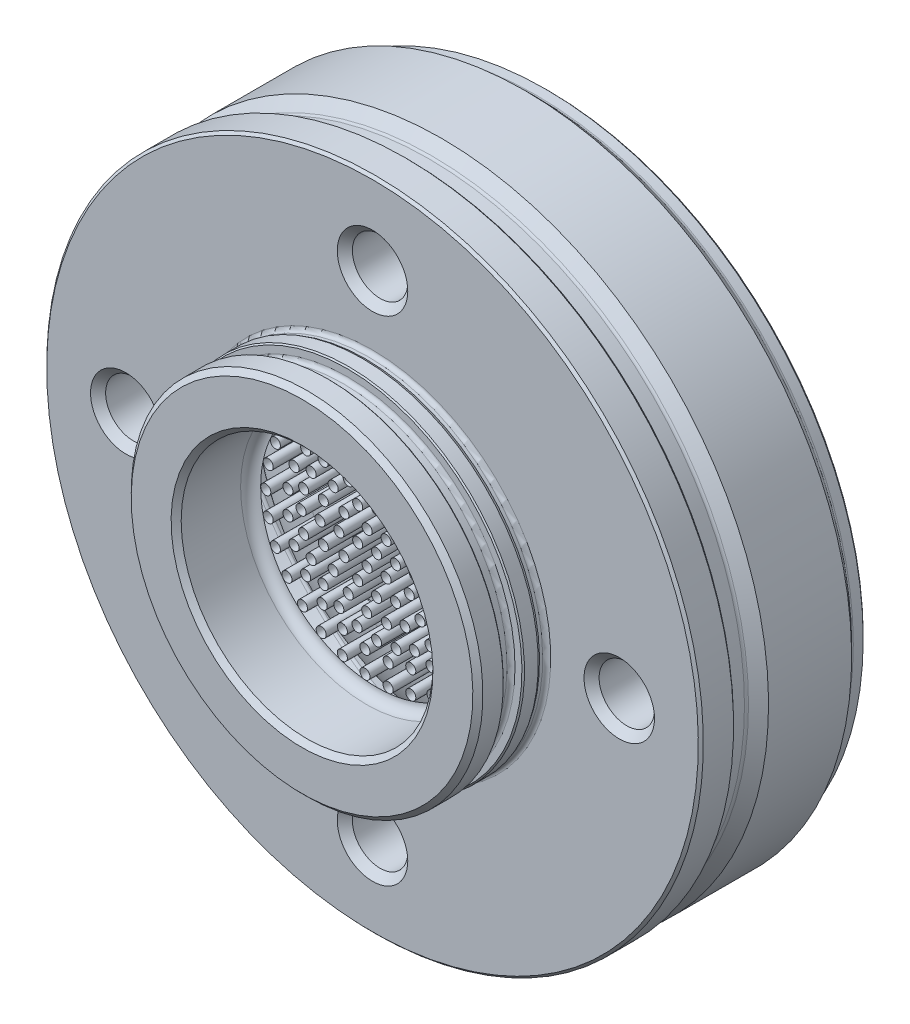
from build123d import *

# Parameters (mm, degrees)
M2_0_2_DIAMETER_HOLE5_AT_2_COUNT     = 2
M2_0_2_DIAMETER_HOLE5_AT_2_PITCH     = 3.75
M2_0_2_DIAMETER_HOLE5_AT_3_COUNT     = 2
M2_0_2_DIAMETER_HOLE5_AT_3_PITCH     = 7.5
M2_0_2_DIAMETER_HOLE5_AT_4_COUNT     = 2
M2_0_2_DIAMETER_HOLE5_AT_4_PITCH     = 11.25
M2_0_2_DIAMETER_HOLE5_AT_5_COUNT     = 2
M2_0_2_DIAMETER_HOLE5_AT_5_PITCH     = 15
M2_0_2_DIAMETER_HOLE5_AT_6_COUNT     = 2
M2_0_2_DIAMETER_HOLE5_AT_6_PITCH     = 22
M2_0_2_DIAMETER_HOLE5_AT_7_COUNT     = 2
M2_0_2_DIAMETER_HOLE5_AT_7_PITCH     = 17.75
M2_0_2_DIAMETER_HOLE5_AT_8_COUNT     = 2
M2_0_2_DIAMETER_HOLE5_AT_8_PITCH     = 3.75
M2_0_2_DIAMETER_HOLE5_AT_9_COUNT     = 2
M2_0_2_DIAMETER_HOLE5_AT_9_PITCH     = 3.75
M2_0_2_DIAMETER_HOLE5_AT_10_COUNT    = 2
M2_0_2_DIAMETER_HOLE5_AT_10_PITCH    = 3.75
M2_0_2_DIAMETER_HOLE5_AT_11_COUNT    = 2
M2_0_2_DIAMETER_HOLE5_AT_11_PITCH    = 3.75
M2_0_2_DIAMETER_HOLE5_AT_12_COUNT    = 2
M2_0_2_DIAMETER_HOLE5_AT_12_PITCH    = 3.75
M2_0_2_DIAMETER_HOLE5_AT_13_COUNT    = 2
M2_0_2_DIAMETER_HOLE5_AT_13_PITCH    = 7.5
M2_0_2_DIAMETER_HOLE5_AT_14_COUNT    = 2
M2_0_2_DIAMETER_HOLE5_AT_14_PITCH    = 7.5
M2_0_2_DIAMETER_HOLE5_AT_15_COUNT    = 2
M2_0_2_DIAMETER_HOLE5_AT_15_PITCH    = 7.5
M2_0_2_DIAMETER_HOLE5_AT_16_COUNT    = 2
M2_0_2_DIAMETER_HOLE5_AT_16_PITCH    = 7.5
M2_0_2_DIAMETER_HOLE5_AT_17_COUNT    = 2
M2_0_2_DIAMETER_HOLE5_AT_17_PITCH    = 7.5
M2_0_2_DIAMETER_HOLE5_AT_18_COUNT    = 2
M2_0_2_DIAMETER_HOLE5_AT_18_PITCH    = 7.5
M2_0_2_DIAMETER_HOLE5_AT_19_COUNT    = 2
M2_0_2_DIAMETER_HOLE5_AT_19_PITCH    = 7.5
M2_0_2_DIAMETER_HOLE5_AT_20_COUNT    = 2
M2_0_2_DIAMETER_HOLE5_AT_20_PITCH    = 7.5
M2_0_2_DIAMETER_HOLE5_AT_21_COUNT    = 2
M2_0_2_DIAMETER_HOLE5_AT_21_PITCH    = 7.5
M2_0_2_DIAMETER_HOLE5_AT_22_COUNT    = 2
M2_0_2_DIAMETER_HOLE5_AT_22_PITCH    = 7.5
M2_0_2_DIAMETER_HOLE5_AT_23_COUNT    = 2
M2_0_2_DIAMETER_HOLE5_AT_23_PITCH    = 7.5
M2_0_2_DIAMETER_HOLE5_AT_24_COUNT    = 2
M2_0_2_DIAMETER_HOLE5_AT_24_PITCH    = 11.25
M2_0_2_DIAMETER_HOLE5_AT_25_COUNT    = 2
M2_0_2_DIAMETER_HOLE5_AT_25_PITCH    = 11.25
M2_0_2_DIAMETER_HOLE5_AT_26_COUNT    = 2
M2_0_2_DIAMETER_HOLE5_AT_26_PITCH    = 11.25
M2_0_2_DIAMETER_HOLE5_AT_27_COUNT    = 2
M2_0_2_DIAMETER_HOLE5_AT_27_PITCH    = 11.25
M2_0_2_DIAMETER_HOLE5_AT_28_COUNT    = 2
M2_0_2_DIAMETER_HOLE5_AT_28_PITCH    = 11.25
M2_0_2_DIAMETER_HOLE5_AT_29_COUNT    = 2
M2_0_2_DIAMETER_HOLE5_AT_29_PITCH    = 11.25
M2_0_2_DIAMETER_HOLE5_AT_30_COUNT    = 2
M2_0_2_DIAMETER_HOLE5_AT_30_PITCH    = 11.25
M2_0_2_DIAMETER_HOLE5_AT_31_COUNT    = 2
M2_0_2_DIAMETER_HOLE5_AT_31_PITCH    = 11.25
M2_0_2_DIAMETER_HOLE5_AT_32_COUNT    = 2
M2_0_2_DIAMETER_HOLE5_AT_32_PITCH    = 11.25
M2_0_2_DIAMETER_HOLE5_AT_33_COUNT    = 2
M2_0_2_DIAMETER_HOLE5_AT_33_PITCH    = 11.25
M2_0_2_DIAMETER_HOLE5_AT_34_COUNT    = 2
M2_0_2_DIAMETER_HOLE5_AT_34_PITCH    = 11.25
M2_0_2_DIAMETER_HOLE5_AT_35_COUNT    = 2
M2_0_2_DIAMETER_HOLE5_AT_35_PITCH    = 11.25
M2_0_2_DIAMETER_HOLE5_AT_36_COUNT    = 2
M2_0_2_DIAMETER_HOLE5_AT_36_PITCH    = 11.25
M2_0_2_DIAMETER_HOLE5_AT_37_COUNT    = 2
M2_0_2_DIAMETER_HOLE5_AT_37_PITCH    = 11.25
M2_0_2_DIAMETER_HOLE5_AT_38_COUNT    = 2
M2_0_2_DIAMETER_HOLE5_AT_38_PITCH    = 11.25
M2_0_2_DIAMETER_HOLE5_AT_39_COUNT    = 2
M2_0_2_DIAMETER_HOLE5_AT_39_PITCH    = 11.25
M2_0_2_DIAMETER_HOLE5_AT_40_COUNT    = 2
M2_0_2_DIAMETER_HOLE5_AT_40_PITCH    = 11.25
M2_0_2_DIAMETER_HOLE5_AT_41_COUNT    = 2
M2_0_2_DIAMETER_HOLE5_AT_41_PITCH    = 15
M2_0_2_DIAMETER_HOLE5_AT_42_COUNT    = 2
M2_0_2_DIAMETER_HOLE5_AT_42_PITCH    = 15
M2_0_2_DIAMETER_HOLE5_AT_43_COUNT    = 2
M2_0_2_DIAMETER_HOLE5_AT_43_PITCH    = 15
M2_0_2_DIAMETER_HOLE5_AT_44_COUNT    = 2
M2_0_2_DIAMETER_HOLE5_AT_44_PITCH    = 15
M2_0_2_DIAMETER_HOLE5_AT_45_COUNT    = 2
M2_0_2_DIAMETER_HOLE5_AT_45_PITCH    = 15
M2_0_2_DIAMETER_HOLE5_AT_46_COUNT    = 2
M2_0_2_DIAMETER_HOLE5_AT_46_PITCH    = 15
M2_0_2_DIAMETER_HOLE5_AT_47_COUNT    = 2
M2_0_2_DIAMETER_HOLE5_AT_47_PITCH    = 15
M2_0_2_DIAMETER_HOLE5_AT_48_COUNT    = 2
M2_0_2_DIAMETER_HOLE5_AT_48_PITCH    = 15
M2_0_2_DIAMETER_HOLE5_AT_49_COUNT    = 2
M2_0_2_DIAMETER_HOLE5_AT_49_PITCH    = 15
M2_0_2_DIAMETER_HOLE5_AT_50_COUNT    = 2
M2_0_2_DIAMETER_HOLE5_AT_50_PITCH    = 15
M2_0_2_DIAMETER_HOLE5_AT_51_COUNT    = 2
M2_0_2_DIAMETER_HOLE5_AT_51_PITCH    = 15
M2_0_2_DIAMETER_HOLE5_AT_52_COUNT    = 2
M2_0_2_DIAMETER_HOLE5_AT_52_PITCH    = 15
M2_0_2_DIAMETER_HOLE5_AT_53_COUNT    = 2
M2_0_2_DIAMETER_HOLE5_AT_53_PITCH    = 15
M2_0_2_DIAMETER_HOLE5_AT_54_COUNT    = 2
M2_0_2_DIAMETER_HOLE5_AT_54_PITCH    = 15
M2_0_2_DIAMETER_HOLE5_AT_55_COUNT    = 2
M2_0_2_DIAMETER_HOLE5_AT_55_PITCH    = 15
M2_0_2_DIAMETER_HOLE5_AT_56_COUNT    = 2
M2_0_2_DIAMETER_HOLE5_AT_56_PITCH    = 15
M2_0_2_DIAMETER_HOLE5_AT_57_COUNT    = 2
M2_0_2_DIAMETER_HOLE5_AT_57_PITCH    = 15
M2_0_2_DIAMETER_HOLE5_AT_58_COUNT    = 2
M2_0_2_DIAMETER_HOLE5_AT_58_PITCH    = 15
M2_0_2_DIAMETER_HOLE5_AT_59_COUNT    = 2
M2_0_2_DIAMETER_HOLE5_AT_59_PITCH    = 15
M2_0_2_DIAMETER_HOLE5_AT_60_COUNT    = 2
M2_0_2_DIAMETER_HOLE5_AT_60_PITCH    = 15
M2_0_2_DIAMETER_HOLE5_AT_61_COUNT    = 2
M2_0_2_DIAMETER_HOLE5_AT_61_PITCH    = 15
M2_0_2_DIAMETER_HOLE5_AT_62_COUNT    = 2
M2_0_2_DIAMETER_HOLE5_AT_62_PITCH    = 15
M2_0_2_DIAMETER_HOLE5_AT_63_COUNT    = 2
M2_0_2_DIAMETER_HOLE5_AT_63_PITCH    = 15
M2_0_2_DIAMETER_HOLE5_AT_64_COUNT    = 2
M2_0_2_DIAMETER_HOLE5_AT_64_PITCH    = 17.75
M2_0_2_DIAMETER_HOLE5_AT_65_COUNT    = 2
M2_0_2_DIAMETER_HOLE5_AT_65_PITCH    = 17.75
M2_0_2_DIAMETER_HOLE5_AT_66_COUNT    = 2
M2_0_2_DIAMETER_HOLE5_AT_66_PITCH    = 17.75
M2_0_2_DIAMETER_HOLE5_AT_67_COUNT    = 2
M2_0_2_DIAMETER_HOLE5_AT_67_PITCH    = 17.75
M2_0_2_DIAMETER_HOLE5_AT_68_COUNT    = 2
M2_0_2_DIAMETER_HOLE5_AT_68_PITCH    = 17.75
M2_0_2_DIAMETER_HOLE5_AT_69_COUNT    = 2
M2_0_2_DIAMETER_HOLE5_AT_69_PITCH    = 17.75
M2_0_2_DIAMETER_HOLE5_AT_70_COUNT    = 2
M2_0_2_DIAMETER_HOLE5_AT_70_PITCH    = 17.75
M2_0_2_DIAMETER_HOLE5_AT_71_COUNT    = 2
M2_0_2_DIAMETER_HOLE5_AT_71_PITCH    = 17.75
M2_0_2_DIAMETER_HOLE5_AT_72_COUNT    = 2
M2_0_2_DIAMETER_HOLE5_AT_72_PITCH    = 17.75
M2_0_2_DIAMETER_HOLE5_AT_73_COUNT    = 2
M2_0_2_DIAMETER_HOLE5_AT_73_PITCH    = 17.75
M2_0_2_DIAMETER_HOLE5_AT_74_COUNT    = 2
M2_0_2_DIAMETER_HOLE5_AT_74_PITCH    = 17.75
M2_0_2_DIAMETER_HOLE5_AT_75_COUNT    = 2
M2_0_2_DIAMETER_HOLE5_AT_75_PITCH    = 17.75
M2_0_2_DIAMETER_HOLE5_AT_76_COUNT    = 2
M2_0_2_DIAMETER_HOLE5_AT_76_PITCH    = 17.75
M2_0_2_DIAMETER_HOLE5_AT_77_COUNT    = 2
M2_0_2_DIAMETER_HOLE5_AT_77_PITCH    = 17.75
M2_0_2_DIAMETER_HOLE5_AT_78_COUNT    = 2
M2_0_2_DIAMETER_HOLE5_AT_78_PITCH    = 17.75
M2_0_2_DIAMETER_HOLE5_AT_79_COUNT    = 2
M2_0_2_DIAMETER_HOLE5_AT_79_PITCH    = 17.75
M2_0_2_DIAMETER_HOLE5_AT_80_COUNT    = 2
M2_0_2_DIAMETER_HOLE5_AT_80_PITCH    = 17.75
M2_0_2_DIAMETER_HOLE5_AT_81_COUNT    = 2
M2_0_2_DIAMETER_HOLE5_AT_81_PITCH    = 17.75
M2_0_2_DIAMETER_HOLE5_AT_82_COUNT    = 2
M2_0_2_DIAMETER_HOLE5_AT_82_PITCH    = 17.75
M2_0_2_DIAMETER_HOLE5_AT_83_COUNT    = 2
M2_0_2_DIAMETER_HOLE5_AT_83_PITCH    = 17.75
M2_0_2_DIAMETER_HOLE5_AT_84_COUNT    = 2
M2_0_2_DIAMETER_HOLE5_AT_84_PITCH    = 17.75
M2_0_2_DIAMETER_HOLE5_AT_85_COUNT    = 2
M2_0_2_DIAMETER_HOLE5_AT_85_PITCH    = 17.75
M2_0_2_DIAMETER_HOLE5_AT_86_COUNT    = 2
M2_0_2_DIAMETER_HOLE5_AT_86_PITCH    = 17.75
M2_0_2_DIAMETER_HOLE5_AT_87_COUNT    = 2
M2_0_2_DIAMETER_HOLE5_AT_87_PITCH    = 22
M2_0_2_DIAMETER_HOLE5_AT_88_COUNT    = 2
M2_0_2_DIAMETER_HOLE5_AT_88_PITCH    = 22
M2_0_2_DIAMETER_HOLE5_AT_89_COUNT    = 2
M2_0_2_DIAMETER_HOLE5_AT_89_PITCH    = 22
M2_0_2_DIAMETER_HOLE5_AT_90_COUNT    = 2
M2_0_2_DIAMETER_HOLE5_AT_90_PITCH    = 22
M2_0_2_DIAMETER_HOLE5_AT_91_COUNT    = 2
M2_0_2_DIAMETER_HOLE5_AT_91_PITCH    = 22
M2_0_2_DIAMETER_HOLE5_AT_92_COUNT    = 2
M2_0_2_DIAMETER_HOLE5_AT_92_PITCH    = 22
M2_0_2_DIAMETER_HOLE5_AT_93_COUNT    = 2
M2_0_2_DIAMETER_HOLE5_AT_93_PITCH    = 22
M2_0_2_DIAMETER_HOLE5_AT_94_COUNT    = 2
M2_0_2_DIAMETER_HOLE5_AT_94_PITCH    = 22
M2_0_2_DIAMETER_HOLE5_AT_95_COUNT    = 2
M2_0_2_DIAMETER_HOLE5_AT_95_PITCH    = 22
M2_0_2_DIAMETER_HOLE5_AT_96_COUNT    = 2
M2_0_2_DIAMETER_HOLE5_AT_96_PITCH    = 22
M2_0_2_DIAMETER_HOLE5_AT_97_COUNT    = 2
M2_0_2_DIAMETER_HOLE5_AT_97_PITCH    = 22
M2_0_2_DIAMETER_HOLE5_AT_98_COUNT    = 2
M2_0_2_DIAMETER_HOLE5_AT_98_PITCH    = 22
M2_0_2_DIAMETER_HOLE5_AT_99_COUNT    = 2
M2_0_2_DIAMETER_HOLE5_AT_99_PITCH    = 22
M2_0_2_DIAMETER_HOLE5_AT_100_COUNT   = 2
M2_0_2_DIAMETER_HOLE5_AT_100_PITCH   = 22
M2_0_2_DIAMETER_HOLE5_AT_101_COUNT   = 2
M2_0_2_DIAMETER_HOLE5_AT_101_PITCH   = 22
M2_0_2_DIAMETER_HOLE5_AT_102_COUNT   = 2
M2_0_2_DIAMETER_HOLE5_AT_102_PITCH   = 22
M2_0_2_DIAMETER_HOLE5_AT_103_COUNT   = 2
M2_0_2_DIAMETER_HOLE5_AT_103_PITCH   = 22
M2_0_2_DIAMETER_HOLE5_AT_104_COUNT   = 2
M2_0_2_DIAMETER_HOLE5_AT_104_PITCH   = 22
M2_0_2_DIAMETER_HOLE5_AT_105_COUNT   = 2
M2_0_2_DIAMETER_HOLE5_AT_105_PITCH   = 22
M2_0_2_DIAMETER_HOLE5_AT_106_COUNT   = 2
M2_0_2_DIAMETER_HOLE5_AT_106_PITCH   = 22
M2_0_2_DIAMETER_HOLE5_AT_107_COUNT   = 2
M2_0_2_DIAMETER_HOLE5_AT_107_PITCH   = 22
M2_0_2_DIAMETER_HOLE5_AT_108_COUNT   = 2
M2_0_2_DIAMETER_HOLE5_AT_108_PITCH   = 22
M2_0_2_DIAMETER_HOLE5_AT_109_COUNT   = 2
M2_0_2_DIAMETER_HOLE5_AT_109_PITCH   = 22
M2_0_2_DIAMETER_HOLE5_AT_110_COUNT   = 2
M2_0_2_DIAMETER_HOLE5_AT_110_PITCH   = 22
M2_0_2_DIAMETER_HOLE5_AT_111_COUNT   = 2
M2_0_2_DIAMETER_HOLE5_AT_111_PITCH   = 22
M2_0_2_DIAMETER_HOLE5_AT_112_COUNT   = 2
M2_0_2_DIAMETER_HOLE5_AT_112_PITCH   = 22
M2_0_2_DIAMETER_HOLE5_AT_113_COUNT   = 2
M2_0_2_DIAMETER_HOLE5_AT_113_PITCH   = 22
M2_0_2_DIAMETER_HOLE5_AT_114_COUNT   = 2
M2_0_2_DIAMETER_HOLE5_AT_114_PITCH   = 22
M2_0_2_DIAMETER_HOLE5_AT_115_COUNT   = 2
M2_0_2_DIAMETER_HOLE5_AT_115_PITCH   = 22
F_11_0_11_DIAMETER_HOLE1_D           = 11
F_11_0_11_DIAMETER_HOLE1_DEPTH       = 12.5
F_11_0_11_DIAMETER_HOLE1_CSINK_D     = 14
F_11_0_11_DIAMETER_HOLE1_CSINK_ANGLE = 90
F_11_0_11_DIAMETER_HOLE1_TIP         = 3.304733405


with BuildPart() as part:
    # Sketch1 → Revolve1 (revolve)
    with BuildSketch(Plane(origin=(0, 0, 0), x_dir=(0, 0, -1), z_dir=(1, 0, 0))):
        with BuildLine():
            Line((0, 50.5), (0, 62.55))
            Line((0, 62.55), (-0.5, 63.05))
            Line((-0.5, 63.05), (-2.46862915, 63.05))
            ThreePointArc((-2.46862915, 63.05), (-2.774775896, 63.110896374), (-3.034314575, 63.284314575))
            Line((-3.034314575, 63.284314575), (-4.675, 64.925))
            Line((-4.675, 64.925), (-21.175, 64.925))
            Line((-21.175, 64.925), (-23.165685425, 62.934314575))
            ThreePointArc((-23.165685425, 62.934314575), (-23.425224104, 62.760896374), (-23.73137085, 62.7))
            Line((-23.73137085, 62.7), (-27.1, 62.7))
            ThreePointArc((-27.1, 62.7), (-27.665685425, 62.934314575), (-27.9, 63.5))
            Line((-27.9, 63.5), (-27.9, 64.7))
            Line((-27.9, 64.7), (-28.4, 65.2))
            Line((-28.4, 65.2), (-34.4, 65.2))
            Line((-34.4, 65.2), (-34.9, 64.7))
            Line((-34.9, 64.7), (-34.9, 35.4))
            ThreePointArc((-34.9, 35.4), (-35.134314575, 34.834314575), (-35.7, 34.6))
            Line((-35.7, 34.6), (-36.337083488, 34.6))
            Line((-36.337083488, 34.6), (-36.9, 34.925))
            Line((-36.9, 34.925), (-39.65, 34.925))
            Line((-39.65, 34.925), (-39.9, 34.675))
            Line((-39.9, 34.675), (-39.9, 33.3))
            ThreePointArc((-39.9, 33.3), (-40.134314575, 32.734314575), (-40.7, 32.5))
            Line((-40.7, 32.5), (-42.8, 32.5))
            ThreePointArc((-42.8, 32.5), (-43.365685425, 32.734314575), (-43.6, 33.3))
            Line((-43.6, 33.3), (-43.6, 34.675))
            Line((-43.6, 34.675), (-43.85, 34.925))
            Line((-43.85, 34.925), (-47.9, 34.925))
            Line((-47.9, 34.925), (-48.9, 33.925))
            Line((-48.9, 33.925), (-48.9, 26))
            Line((-48.9, 26), (-47.9, 25))
            Line((-47.9, 25), (-36.1, 25))
            ThreePointArc((-36.1, 25), (-34.685786438, 24.414213562), (-34.1, 23))
            Line((-34.1, 23), (-34.1, 0))
            Line((-34.1, 0), (-24.8, 0))
            Line((-24.8, 0), (-24.8, 23.589778894))
            ThreePointArc((-24.8, 23.589778894), (-18.448418248, 39.854259621), (-2.755555556, 47.509975433))
            ThreePointArc((-2.755555556, 47.509975433), (-0.793947719, 48.466939909), (0, 50.5))
        make_face()
    revolve(axis=Axis((0, 0, 0), (0, 0, 1)))

    # Sketch13 → M2.0 (2) Diameter Hole5 (revolve, cut)
    with BuildSketch(Plane(origin=(0, 0, 34.1), x_dir=(0, -1, 0), z_dir=(1, 0, 0))):
        Polygon((0, 0), (0, 9.3), (1.1, 9.3), (1, 9.2), (1, 0), align=None)
    m2_0_2_diameter_hole5 = revolve(axis=Axis((0, 0, 40.45), (0, 0, -1)), mode=Mode.SUBTRACT)

    # M2.0 (2) Diameter Hole5 at 2: M2.0 (2) Diameter Hole5 ×2
    with Locations(*[(i * M2_0_2_DIAMETER_HOLE5_AT_2_PITCH, 0, 0) for i in range(1, M2_0_2_DIAMETER_HOLE5_AT_2_COUNT)]):
        add(m2_0_2_diameter_hole5, mode=Mode.SUBTRACT)

    # M2.0 (2) Diameter Hole5 at 3: M2.0 (2) Diameter Hole5 ×2
    with Locations(*[(i * M2_0_2_DIAMETER_HOLE5_AT_3_PITCH, 0, 0) for i in range(1, M2_0_2_DIAMETER_HOLE5_AT_3_COUNT)]):
        add(m2_0_2_diameter_hole5, mode=Mode.SUBTRACT)

    # M2.0 (2) Diameter Hole5 at 4: M2.0 (2) Diameter Hole5 ×2
    with Locations(*[(i * M2_0_2_DIAMETER_HOLE5_AT_4_PITCH, 0, 0) for i in range(1, M2_0_2_DIAMETER_HOLE5_AT_4_COUNT)]):
        add(m2_0_2_diameter_hole5, mode=Mode.SUBTRACT)

    # M2.0 (2) Diameter Hole5 at 5: M2.0 (2) Diameter Hole5 ×2
    with Locations(*[(i * M2_0_2_DIAMETER_HOLE5_AT_5_PITCH, 0, 0) for i in range(1, M2_0_2_DIAMETER_HOLE5_AT_5_COUNT)]):
        add(m2_0_2_diameter_hole5, mode=Mode.SUBTRACT)

    # M2.0 (2) Diameter Hole5 at 6: M2.0 (2) Diameter Hole5 ×2
    with Locations(*[(i * M2_0_2_DIAMETER_HOLE5_AT_6_PITCH, 0, 0) for i in range(1, M2_0_2_DIAMETER_HOLE5_AT_6_COUNT)]):
        add(m2_0_2_diameter_hole5, mode=Mode.SUBTRACT)

    # M2.0 (2) Diameter Hole5 at 7: M2.0 (2) Diameter Hole5 ×2
    with Locations(*[Vector(0.9914448613738122, 0.13052619222003806, 0) * (i * M2_0_2_DIAMETER_HOLE5_AT_7_PITCH) for i in range(1, M2_0_2_DIAMETER_HOLE5_AT_7_COUNT)]):
        add(m2_0_2_diameter_hole5, mode=Mode.SUBTRACT)

    # M2.0 (2) Diameter Hole5 at 8: M2.0 (2) Diameter Hole5 ×2
    with Locations(*[Vector(0.5000000000000118, 0.8660254037844319, 0) * (i * M2_0_2_DIAMETER_HOLE5_AT_8_PITCH) for i in range(1, M2_0_2_DIAMETER_HOLE5_AT_8_COUNT)]):
        add(m2_0_2_diameter_hole5, mode=Mode.SUBTRACT)

    # M2.0 (2) Diameter Hole5 at 9: M2.0 (2) Diameter Hole5 ×2
    with Locations(*[Vector(-0.4999999999999935, 0.8660254037844424, 0) * (i * M2_0_2_DIAMETER_HOLE5_AT_9_PITCH) for i in range(1, M2_0_2_DIAMETER_HOLE5_AT_9_COUNT)]):
        add(m2_0_2_diameter_hole5, mode=Mode.SUBTRACT)

    # M2.0 (2) Diameter Hole5 at 10: M2.0 (2) Diameter Hole5 ×2
    with Locations(*[(-i * M2_0_2_DIAMETER_HOLE5_AT_10_PITCH, 0, 0) for i in range(1, M2_0_2_DIAMETER_HOLE5_AT_10_COUNT)]):
        add(m2_0_2_diameter_hole5, mode=Mode.SUBTRACT)

    # M2.0 (2) Diameter Hole5 at 11: M2.0 (2) Diameter Hole5 ×2
    with Locations(*[Vector(-0.5000000000000026, -0.8660254037844373, 0) * (i * M2_0_2_DIAMETER_HOLE5_AT_11_PITCH) for i in range(1, M2_0_2_DIAMETER_HOLE5_AT_11_COUNT)]):
        add(m2_0_2_diameter_hole5, mode=Mode.SUBTRACT)

    # M2.0 (2) Diameter Hole5 at 12: M2.0 (2) Diameter Hole5 ×2
    with Locations(*[Vector(0.49999999999999645, -0.8660254037844407, 0) * (i * M2_0_2_DIAMETER_HOLE5_AT_12_PITCH) for i in range(1, M2_0_2_DIAMETER_HOLE5_AT_12_COUNT)]):
        add(m2_0_2_diameter_hole5, mode=Mode.SUBTRACT)

    # M2.0 (2) Diameter Hole5 at 13: M2.0 (2) Diameter Hole5 ×2
    with Locations(*[Vector(0.8660254037844458, 0.4999999999999875, 0) * (i * M2_0_2_DIAMETER_HOLE5_AT_13_PITCH) for i in range(1, M2_0_2_DIAMETER_HOLE5_AT_13_COUNT)]):
        add(m2_0_2_diameter_hole5, mode=Mode.SUBTRACT)

    # M2.0 (2) Diameter Hole5 at 14: M2.0 (2) Diameter Hole5 ×2
    with Locations(*[Vector(0.500000000000011, 0.8660254037844324, 0) * (i * M2_0_2_DIAMETER_HOLE5_AT_14_PITCH) for i in range(1, M2_0_2_DIAMETER_HOLE5_AT_14_COUNT)]):
        add(m2_0_2_diameter_hole5, mode=Mode.SUBTRACT)

    # M2.0 (2) Diameter Hole5 at 15: M2.0 (2) Diameter Hole5 ×2
    with Locations(*[(0, i * M2_0_2_DIAMETER_HOLE5_AT_15_PITCH, 0) for i in range(1, M2_0_2_DIAMETER_HOLE5_AT_15_COUNT)]):
        add(m2_0_2_diameter_hole5, mode=Mode.SUBTRACT)

    # M2.0 (2) Diameter Hole5 at 16: M2.0 (2) Diameter Hole5 ×2
    with Locations(*[Vector(-0.49999999999999273, 0.8660254037844428, 0) * (i * M2_0_2_DIAMETER_HOLE5_AT_16_PITCH) for i in range(1, M2_0_2_DIAMETER_HOLE5_AT_16_COUNT)]):
        add(m2_0_2_diameter_hole5, mode=Mode.SUBTRACT)

    # M2.0 (2) Diameter Hole5 at 17: M2.0 (2) Diameter Hole5 ×2
    with Locations(*[Vector(-0.8660254037844354, 0.5000000000000058, 0) * (i * M2_0_2_DIAMETER_HOLE5_AT_17_PITCH) for i in range(1, M2_0_2_DIAMETER_HOLE5_AT_17_COUNT)]):
        add(m2_0_2_diameter_hole5, mode=Mode.SUBTRACT)

    # M2.0 (2) Diameter Hole5 at 18: M2.0 (2) Diameter Hole5 ×2
    with Locations(*[(-i * M2_0_2_DIAMETER_HOLE5_AT_18_PITCH, 0, 0) for i in range(1, M2_0_2_DIAMETER_HOLE5_AT_18_COUNT)]):
        add(m2_0_2_diameter_hole5, mode=Mode.SUBTRACT)

    # M2.0 (2) Diameter Hole5 at 19: M2.0 (2) Diameter Hole5 ×2
    with Locations(*[Vector(-0.8660254037844408, -0.49999999999999634, 0) * (i * M2_0_2_DIAMETER_HOLE5_AT_19_PITCH) for i in range(1, M2_0_2_DIAMETER_HOLE5_AT_19_COUNT)]):
        add(m2_0_2_diameter_hole5, mode=Mode.SUBTRACT)

    # M2.0 (2) Diameter Hole5 at 20: M2.0 (2) Diameter Hole5 ×2
    with Locations(*[Vector(-0.5000000000000033, -0.8660254037844368, 0) * (i * M2_0_2_DIAMETER_HOLE5_AT_20_PITCH) for i in range(1, M2_0_2_DIAMETER_HOLE5_AT_20_COUNT)]):
        add(m2_0_2_diameter_hole5, mode=Mode.SUBTRACT)

    # M2.0 (2) Diameter Hole5 at 21: M2.0 (2) Diameter Hole5 ×2
    with Locations(*[(0, -i * M2_0_2_DIAMETER_HOLE5_AT_21_PITCH, 0) for i in range(1, M2_0_2_DIAMETER_HOLE5_AT_21_COUNT)]):
        add(m2_0_2_diameter_hole5, mode=Mode.SUBTRACT)

    # M2.0 (2) Diameter Hole5 at 22: M2.0 (2) Diameter Hole5 ×2
    with Locations(*[Vector(0.4999999999999972, -0.8660254037844403, 0) * (i * M2_0_2_DIAMETER_HOLE5_AT_22_PITCH) for i in range(1, M2_0_2_DIAMETER_HOLE5_AT_22_COUNT)]):
        add(m2_0_2_diameter_hole5, mode=Mode.SUBTRACT)

    # M2.0 (2) Diameter Hole5 at 23: M2.0 (2) Diameter Hole5 ×2
    with Locations(*[Vector(0.8660254037844374, -0.5000000000000023, 0) * (i * M2_0_2_DIAMETER_HOLE5_AT_23_PITCH) for i in range(1, M2_0_2_DIAMETER_HOLE5_AT_23_COUNT)]):
        add(m2_0_2_diameter_hole5, mode=Mode.SUBTRACT)

    # M2.0 (2) Diameter Hole5 at 24: M2.0 (2) Diameter Hole5 ×2
    with Locations(*[Vector(0.9396926207859131, 0.34202014332565583, 0) * (i * M2_0_2_DIAMETER_HOLE5_AT_24_PITCH) for i in range(1, M2_0_2_DIAMETER_HOLE5_AT_24_COUNT)]):
        add(m2_0_2_diameter_hole5, mode=Mode.SUBTRACT)

    # M2.0 (2) Diameter Hole5 at 25: M2.0 (2) Diameter Hole5 ×2
    with Locations(*[Vector(0.7660444431189863, 0.6427876096865294, 0) * (i * M2_0_2_DIAMETER_HOLE5_AT_25_PITCH) for i in range(1, M2_0_2_DIAMETER_HOLE5_AT_25_COUNT)]):
        add(m2_0_2_diameter_hole5, mode=Mode.SUBTRACT)

    # M2.0 (2) Diameter Hole5 at 26: M2.0 (2) Diameter Hole5 ×2
    with Locations(*[Vector(0.5000000000000107, 0.8660254037844326, 0) * (i * M2_0_2_DIAMETER_HOLE5_AT_26_PITCH) for i in range(1, M2_0_2_DIAMETER_HOLE5_AT_26_COUNT)]):
        add(m2_0_2_diameter_hole5, mode=Mode.SUBTRACT)

    # M2.0 (2) Diameter Hole5 at 27: M2.0 (2) Diameter Hole5 ×2
    with Locations(*[Vector(0.17364817766694066, 0.9848077530122062, 0) * (i * M2_0_2_DIAMETER_HOLE5_AT_27_PITCH) for i in range(1, M2_0_2_DIAMETER_HOLE5_AT_27_COUNT)]):
        add(m2_0_2_diameter_hole5, mode=Mode.SUBTRACT)

    # M2.0 (2) Diameter Hole5 at 28: M2.0 (2) Diameter Hole5 ×2
    with Locations(*[Vector(-0.17364817766692087, 0.9848077530122097, 0) * (i * M2_0_2_DIAMETER_HOLE5_AT_28_PITCH) for i in range(1, M2_0_2_DIAMETER_HOLE5_AT_28_COUNT)]):
        add(m2_0_2_diameter_hole5, mode=Mode.SUBTRACT)

    # M2.0 (2) Diameter Hole5 at 29: M2.0 (2) Diameter Hole5 ×2
    with Locations(*[Vector(-0.49999999999999245, 0.866025403784443, 0) * (i * M2_0_2_DIAMETER_HOLE5_AT_29_PITCH) for i in range(1, M2_0_2_DIAMETER_HOLE5_AT_29_COUNT)]):
        add(m2_0_2_diameter_hole5, mode=Mode.SUBTRACT)

    # M2.0 (2) Diameter Hole5 at 30: M2.0 (2) Diameter Hole5 ×2
    with Locations(*[Vector(-0.7660444431189732, 0.6427876096865451, 0) * (i * M2_0_2_DIAMETER_HOLE5_AT_30_PITCH) for i in range(1, M2_0_2_DIAMETER_HOLE5_AT_30_COUNT)]):
        add(m2_0_2_diameter_hole5, mode=Mode.SUBTRACT)

    # M2.0 (2) Diameter Hole5 at 31: M2.0 (2) Diameter Hole5 ×2
    with Locations(*[Vector(-0.9396926207859062, 0.3420201433256747, 0) * (i * M2_0_2_DIAMETER_HOLE5_AT_31_PITCH) for i in range(1, M2_0_2_DIAMETER_HOLE5_AT_31_COUNT)]):
        add(m2_0_2_diameter_hole5, mode=Mode.SUBTRACT)

    # M2.0 (2) Diameter Hole5 at 32: M2.0 (2) Diameter Hole5 ×2
    with Locations(*[(-i * M2_0_2_DIAMETER_HOLE5_AT_32_PITCH, 0, 0) for i in range(1, M2_0_2_DIAMETER_HOLE5_AT_32_COUNT)]):
        add(m2_0_2_diameter_hole5, mode=Mode.SUBTRACT)

    # M2.0 (2) Diameter Hole5 at 33: M2.0 (2) Diameter Hole5 ×2
    with Locations(*[Vector(-0.9396926207859101, -0.34202014332566405, 0) * (i * M2_0_2_DIAMETER_HOLE5_AT_33_PITCH) for i in range(1, M2_0_2_DIAMETER_HOLE5_AT_33_COUNT)]):
        add(m2_0_2_diameter_hole5, mode=Mode.SUBTRACT)

    # M2.0 (2) Diameter Hole5 at 34: M2.0 (2) Diameter Hole5 ×2
    with Locations(*[Vector(-0.7660444431189808, -0.6427876096865361, 0) * (i * M2_0_2_DIAMETER_HOLE5_AT_34_PITCH) for i in range(1, M2_0_2_DIAMETER_HOLE5_AT_34_COUNT)]):
        add(m2_0_2_diameter_hole5, mode=Mode.SUBTRACT)

    # M2.0 (2) Diameter Hole5 at 35: M2.0 (2) Diameter Hole5 ×2
    with Locations(*[Vector(-0.5000000000000036, -0.8660254037844366, 0) * (i * M2_0_2_DIAMETER_HOLE5_AT_35_PITCH) for i in range(1, M2_0_2_DIAMETER_HOLE5_AT_35_COUNT)]):
        add(m2_0_2_diameter_hole5, mode=Mode.SUBTRACT)

    # M2.0 (2) Diameter Hole5 at 36: M2.0 (2) Diameter Hole5 ×2
    with Locations(*[Vector(-0.17364817766693386, -0.9848077530122076, 0) * (i * M2_0_2_DIAMETER_HOLE5_AT_36_PITCH) for i in range(1, M2_0_2_DIAMETER_HOLE5_AT_36_COUNT)]):
        add(m2_0_2_diameter_hole5, mode=Mode.SUBTRACT)

    # M2.0 (2) Diameter Hole5 at 37: M2.0 (2) Diameter Hole5 ×2
    with Locations(*[Vector(0.1736481776669272, -0.9848077530122087, 0) * (i * M2_0_2_DIAMETER_HOLE5_AT_37_PITCH) for i in range(1, M2_0_2_DIAMETER_HOLE5_AT_37_COUNT)]):
        add(m2_0_2_diameter_hole5, mode=Mode.SUBTRACT)

    # M2.0 (2) Diameter Hole5 at 38: M2.0 (2) Diameter Hole5 ×2
    with Locations(*[Vector(0.4999999999999975, -0.8660254037844402, 0) * (i * M2_0_2_DIAMETER_HOLE5_AT_38_PITCH) for i in range(1, M2_0_2_DIAMETER_HOLE5_AT_38_COUNT)]):
        add(m2_0_2_diameter_hole5, mode=Mode.SUBTRACT)

    # M2.0 (2) Diameter Hole5 at 39: M2.0 (2) Diameter Hole5 ×2
    with Locations(*[Vector(0.7660444431189766, -0.6427876096865413, 0) * (i * M2_0_2_DIAMETER_HOLE5_AT_39_PITCH) for i in range(1, M2_0_2_DIAMETER_HOLE5_AT_39_COUNT)]):
        add(m2_0_2_diameter_hole5, mode=Mode.SUBTRACT)

    # M2.0 (2) Diameter Hole5 at 40: M2.0 (2) Diameter Hole5 ×2
    with Locations(*[Vector(0.9396926207859078, -0.3420201433256705, 0) * (i * M2_0_2_DIAMETER_HOLE5_AT_40_PITCH) for i in range(1, M2_0_2_DIAMETER_HOLE5_AT_40_COUNT)]):
        add(m2_0_2_diameter_hole5, mode=Mode.SUBTRACT)

    # M2.0 (2) Diameter Hole5 at 41: M2.0 (2) Diameter Hole5 ×2
    with Locations(*[Vector(0.965925826289072, 0.25881904510250703, 0) * (i * M2_0_2_DIAMETER_HOLE5_AT_41_PITCH) for i in range(1, M2_0_2_DIAMETER_HOLE5_AT_41_COUNT)]):
        add(m2_0_2_diameter_hole5, mode=Mode.SUBTRACT)

    # M2.0 (2) Diameter Hole5 at 42: M2.0 (2) Diameter Hole5 ×2
    with Locations(*[Vector(0.8660254037844455, 0.49999999999998823, 0) * (i * M2_0_2_DIAMETER_HOLE5_AT_42_PITCH) for i in range(1, M2_0_2_DIAMETER_HOLE5_AT_42_COUNT)]):
        add(m2_0_2_diameter_hole5, mode=Mode.SUBTRACT)

    # M2.0 (2) Diameter Hole5 at 43: M2.0 (2) Diameter Hole5 ×2
    with Locations(*[Vector(0.7071067811865566, 0.7071067811865386, 0) * (i * M2_0_2_DIAMETER_HOLE5_AT_43_PITCH) for i in range(1, M2_0_2_DIAMETER_HOLE5_AT_43_COUNT)]):
        add(m2_0_2_diameter_hole5, mode=Mode.SUBTRACT)

    # M2.0 (2) Diameter Hole5 at 44: M2.0 (2) Diameter Hole5 ×2
    with Locations(*[Vector(0.5000000000000105, 0.8660254037844326, 0) * (i * M2_0_2_DIAMETER_HOLE5_AT_44_PITCH) for i in range(1, M2_0_2_DIAMETER_HOLE5_AT_44_COUNT)]):
        add(m2_0_2_diameter_hole5, mode=Mode.SUBTRACT)

    # M2.0 (2) Diameter Hole5 at 45: M2.0 (2) Diameter Hole5 ×2
    with Locations(*[Vector(0.2588190451025317, 0.9659258262890654, 0) * (i * M2_0_2_DIAMETER_HOLE5_AT_45_PITCH) for i in range(1, M2_0_2_DIAMETER_HOLE5_AT_45_COUNT)]):
        add(m2_0_2_diameter_hole5, mode=Mode.SUBTRACT)

    # M2.0 (2) Diameter Hole5 at 46: M2.0 (2) Diameter Hole5 ×2
    with Locations(*[(0, i * M2_0_2_DIAMETER_HOLE5_AT_46_PITCH, 0) for i in range(1, M2_0_2_DIAMETER_HOLE5_AT_46_COUNT)]):
        add(m2_0_2_diameter_hole5, mode=Mode.SUBTRACT)

    # M2.0 (2) Diameter Hole5 at 47: M2.0 (2) Diameter Hole5 ×2
    with Locations(*[Vector(-0.25881904510251147, 0.9659258262890709, 0) * (i * M2_0_2_DIAMETER_HOLE5_AT_47_PITCH) for i in range(1, M2_0_2_DIAMETER_HOLE5_AT_47_COUNT)]):
        add(m2_0_2_diameter_hole5, mode=Mode.SUBTRACT)

    # M2.0 (2) Diameter Hole5 at 48: M2.0 (2) Diameter Hole5 ×2
    with Locations(*[Vector(-0.49999999999999234, 0.8660254037844431, 0) * (i * M2_0_2_DIAMETER_HOLE5_AT_48_PITCH) for i in range(1, M2_0_2_DIAMETER_HOLE5_AT_48_COUNT)]):
        add(m2_0_2_diameter_hole5, mode=Mode.SUBTRACT)

    # M2.0 (2) Diameter Hole5 at 49: M2.0 (2) Diameter Hole5 ×2
    with Locations(*[Vector(-0.7071067811865417, 0.7071067811865533, 0) * (i * M2_0_2_DIAMETER_HOLE5_AT_49_PITCH) for i in range(1, M2_0_2_DIAMETER_HOLE5_AT_49_COUNT)]):
        add(m2_0_2_diameter_hole5, mode=Mode.SUBTRACT)

    # M2.0 (2) Diameter Hole5 at 50: M2.0 (2) Diameter Hole5 ×2
    with Locations(*[Vector(-0.8660254037844349, 0.5000000000000064, 0) * (i * M2_0_2_DIAMETER_HOLE5_AT_50_PITCH) for i in range(1, M2_0_2_DIAMETER_HOLE5_AT_50_COUNT)]):
        add(m2_0_2_diameter_hole5, mode=Mode.SUBTRACT)

    # M2.0 (2) Diameter Hole5 at 51: M2.0 (2) Diameter Hole5 ×2
    with Locations(*[Vector(-0.9659258262890665, 0.25881904510252723, 0) * (i * M2_0_2_DIAMETER_HOLE5_AT_51_PITCH) for i in range(1, M2_0_2_DIAMETER_HOLE5_AT_51_COUNT)]):
        add(m2_0_2_diameter_hole5, mode=Mode.SUBTRACT)

    # M2.0 (2) Diameter Hole5 at 52: M2.0 (2) Diameter Hole5 ×2
    with Locations(*[(-i * M2_0_2_DIAMETER_HOLE5_AT_52_PITCH, 0, 0) for i in range(1, M2_0_2_DIAMETER_HOLE5_AT_52_COUNT)]):
        add(m2_0_2_diameter_hole5, mode=Mode.SUBTRACT)

    # M2.0 (2) Diameter Hole5 at 53: M2.0 (2) Diameter Hole5 ×2
    with Locations(*[Vector(-0.9659258262890698, -0.25881904510251547, 0) * (i * M2_0_2_DIAMETER_HOLE5_AT_53_PITCH) for i in range(1, M2_0_2_DIAMETER_HOLE5_AT_53_COUNT)]):
        add(m2_0_2_diameter_hole5, mode=Mode.SUBTRACT)

    # M2.0 (2) Diameter Hole5 at 54: M2.0 (2) Diameter Hole5 ×2
    with Locations(*[Vector(-0.8660254037844412, -0.49999999999999567, 0) * (i * M2_0_2_DIAMETER_HOLE5_AT_54_PITCH) for i in range(1, M2_0_2_DIAMETER_HOLE5_AT_54_COUNT)]):
        add(m2_0_2_diameter_hole5, mode=Mode.SUBTRACT)

    # M2.0 (2) Diameter Hole5 at 55: M2.0 (2) Diameter Hole5 ×2
    with Locations(*[Vector(-0.7071067811865509, -0.7071067811865442, 0) * (i * M2_0_2_DIAMETER_HOLE5_AT_55_PITCH) for i in range(1, M2_0_2_DIAMETER_HOLE5_AT_55_COUNT)]):
        add(m2_0_2_diameter_hole5, mode=Mode.SUBTRACT)

    # M2.0 (2) Diameter Hole5 at 56: M2.0 (2) Diameter Hole5 ×2
    with Locations(*[Vector(-0.5000000000000038, -0.8660254037844366, 0) * (i * M2_0_2_DIAMETER_HOLE5_AT_56_PITCH) for i in range(1, M2_0_2_DIAMETER_HOLE5_AT_56_COUNT)]):
        add(m2_0_2_diameter_hole5, mode=Mode.SUBTRACT)

    # M2.0 (2) Diameter Hole5 at 57: M2.0 (2) Diameter Hole5 ×2
    with Locations(*[Vector(-0.2588190451025245, -0.9659258262890673, 0) * (i * M2_0_2_DIAMETER_HOLE5_AT_57_PITCH) for i in range(1, M2_0_2_DIAMETER_HOLE5_AT_57_COUNT)]):
        add(m2_0_2_diameter_hole5, mode=Mode.SUBTRACT)

    # M2.0 (2) Diameter Hole5 at 58: M2.0 (2) Diameter Hole5 ×2
    with Locations(*[(0, -i * M2_0_2_DIAMETER_HOLE5_AT_58_PITCH, 0) for i in range(1, M2_0_2_DIAMETER_HOLE5_AT_58_COUNT)]):
        add(m2_0_2_diameter_hole5, mode=Mode.SUBTRACT)

    # M2.0 (2) Diameter Hole5 at 59: M2.0 (2) Diameter Hole5 ×2
    with Locations(*[Vector(0.2588190451025178, -0.9659258262890691, 0) * (i * M2_0_2_DIAMETER_HOLE5_AT_59_PITCH) for i in range(1, M2_0_2_DIAMETER_HOLE5_AT_59_COUNT)]):
        add(m2_0_2_diameter_hole5, mode=Mode.SUBTRACT)

    # M2.0 (2) Diameter Hole5 at 60: M2.0 (2) Diameter Hole5 ×2
    with Locations(*[Vector(0.4999999999999976, -0.86602540378444, 0) * (i * M2_0_2_DIAMETER_HOLE5_AT_60_PITCH) for i in range(1, M2_0_2_DIAMETER_HOLE5_AT_60_COUNT)]):
        add(m2_0_2_diameter_hole5, mode=Mode.SUBTRACT)

    # M2.0 (2) Diameter Hole5 at 61: M2.0 (2) Diameter Hole5 ×2
    with Locations(*[Vector(0.7071067811865458, -0.7071067811865492, 0) * (i * M2_0_2_DIAMETER_HOLE5_AT_61_PITCH) for i in range(1, M2_0_2_DIAMETER_HOLE5_AT_61_COUNT)]):
        add(m2_0_2_diameter_hole5, mode=Mode.SUBTRACT)

    # M2.0 (2) Diameter Hole5 at 62: M2.0 (2) Diameter Hole5 ×2
    with Locations(*[Vector(0.8660254037844377, -0.5000000000000018, 0) * (i * M2_0_2_DIAMETER_HOLE5_AT_62_PITCH) for i in range(1, M2_0_2_DIAMETER_HOLE5_AT_62_COUNT)]):
        add(m2_0_2_diameter_hole5, mode=Mode.SUBTRACT)

    # M2.0 (2) Diameter Hole5 at 63: M2.0 (2) Diameter Hole5 ×2
    with Locations(*[Vector(0.965925826289068, -0.25881904510252224, 0) * (i * M2_0_2_DIAMETER_HOLE5_AT_63_PITCH) for i in range(1, M2_0_2_DIAMETER_HOLE5_AT_63_COUNT)]):
        add(m2_0_2_diameter_hole5, mode=Mode.SUBTRACT)

    # M2.0 (2) Diameter Hole5 at 64: M2.0 (2) Diameter Hole5 ×2
    with Locations(*[Vector(0.9238795325112917, 0.38268343236507774, 0) * (i * M2_0_2_DIAMETER_HOLE5_AT_64_PITCH) for i in range(1, M2_0_2_DIAMETER_HOLE5_AT_64_COUNT)]):
        add(m2_0_2_diameter_hole5, mode=Mode.SUBTRACT)

    # M2.0 (2) Diameter Hole5 at 65: M2.0 (2) Diameter Hole5 ×2
    with Locations(*[Vector(0.7933533402912427, 0.608761429008711, 0) * (i * M2_0_2_DIAMETER_HOLE5_AT_65_PITCH) for i in range(1, M2_0_2_DIAMETER_HOLE5_AT_65_COUNT)]):
        add(m2_0_2_diameter_hole5, mode=Mode.SUBTRACT)

    # M2.0 (2) Diameter Hole5 at 66: M2.0 (2) Diameter Hole5 ×2
    with Locations(*[Vector(0.6087614290087299, 0.7933533402912281, 0) * (i * M2_0_2_DIAMETER_HOLE5_AT_66_PITCH) for i in range(1, M2_0_2_DIAMETER_HOLE5_AT_66_COUNT)]):
        add(m2_0_2_diameter_hole5, mode=Mode.SUBTRACT)

    # M2.0 (2) Diameter Hole5 at 67: M2.0 (2) Diameter Hole5 ×2
    with Locations(*[Vector(0.38268343236509994, 0.9238795325112825, 0) * (i * M2_0_2_DIAMETER_HOLE5_AT_67_PITCH) for i in range(1, M2_0_2_DIAMETER_HOLE5_AT_67_COUNT)]):
        add(m2_0_2_diameter_hole5, mode=Mode.SUBTRACT)

    # M2.0 (2) Diameter Hole5 at 68: M2.0 (2) Diameter Hole5 ×2
    with Locations(*[Vector(0.13052619222006168, 0.9914448613738092, 0) * (i * M2_0_2_DIAMETER_HOLE5_AT_68_PITCH) for i in range(1, M2_0_2_DIAMETER_HOLE5_AT_68_COUNT)]):
        add(m2_0_2_diameter_hole5, mode=Mode.SUBTRACT)

    # M2.0 (2) Diameter Hole5 at 69: M2.0 (2) Diameter Hole5 ×2
    with Locations(*[Vector(-0.13052619222004228, 0.9914448613738116, 0) * (i * M2_0_2_DIAMETER_HOLE5_AT_69_PITCH) for i in range(1, M2_0_2_DIAMETER_HOLE5_AT_69_COUNT)]):
        add(m2_0_2_diameter_hole5, mode=Mode.SUBTRACT)

    # M2.0 (2) Diameter Hole5 at 70: M2.0 (2) Diameter Hole5 ×2
    with Locations(*[Vector(-0.38268343236508195, 0.9238795325112901, 0) * (i * M2_0_2_DIAMETER_HOLE5_AT_70_PITCH) for i in range(1, M2_0_2_DIAMETER_HOLE5_AT_70_COUNT)]):
        add(m2_0_2_diameter_hole5, mode=Mode.SUBTRACT)

    # M2.0 (2) Diameter Hole5 at 71: M2.0 (2) Diameter Hole5 ×2
    with Locations(*[Vector(-0.6087614290087144, 0.79335334029124, 0) * (i * M2_0_2_DIAMETER_HOLE5_AT_71_PITCH) for i in range(1, M2_0_2_DIAMETER_HOLE5_AT_71_COUNT)]):
        add(m2_0_2_diameter_hole5, mode=Mode.SUBTRACT)

    # M2.0 (2) Diameter Hole5 at 72: M2.0 (2) Diameter Hole5 ×2
    with Locations(*[Vector(-0.7933533402912308, 0.6087614290087264, 0) * (i * M2_0_2_DIAMETER_HOLE5_AT_72_PITCH) for i in range(1, M2_0_2_DIAMETER_HOLE5_AT_72_COUNT)]):
        add(m2_0_2_diameter_hole5, mode=Mode.SUBTRACT)

    # M2.0 (2) Diameter Hole5 at 73: M2.0 (2) Diameter Hole5 ×2
    with Locations(*[Vector(-0.9238795325112843, 0.3826834323650958, 0) * (i * M2_0_2_DIAMETER_HOLE5_AT_73_PITCH) for i in range(1, M2_0_2_DIAMETER_HOLE5_AT_73_COUNT)]):
        add(m2_0_2_diameter_hole5, mode=Mode.SUBTRACT)

    # M2.0 (2) Diameter Hole5 at 74: M2.0 (2) Diameter Hole5 ×2
    with Locations(*[Vector(-0.9914448613738097, 0.13052619222005737, 0) * (i * M2_0_2_DIAMETER_HOLE5_AT_74_PITCH) for i in range(1, M2_0_2_DIAMETER_HOLE5_AT_74_COUNT)]):
        add(m2_0_2_diameter_hole5, mode=Mode.SUBTRACT)

    # M2.0 (2) Diameter Hole5 at 75: M2.0 (2) Diameter Hole5 ×2
    with Locations(*[Vector(-0.9914448613738112, -0.1305261922200464, 0) * (i * M2_0_2_DIAMETER_HOLE5_AT_75_PITCH) for i in range(1, M2_0_2_DIAMETER_HOLE5_AT_75_COUNT)]):
        add(m2_0_2_diameter_hole5, mode=Mode.SUBTRACT)

    # M2.0 (2) Diameter Hole5 at 76: M2.0 (2) Diameter Hole5 ×2
    with Locations(*[Vector(-0.9238795325112886, -0.3826834323650854, 0) * (i * M2_0_2_DIAMETER_HOLE5_AT_76_PITCH) for i in range(1, M2_0_2_DIAMETER_HOLE5_AT_76_COUNT)]):
        add(m2_0_2_diameter_hole5, mode=Mode.SUBTRACT)

    # M2.0 (2) Diameter Hole5 at 77: M2.0 (2) Diameter Hole5 ×2
    with Locations(*[Vector(-0.7933533402912378, -0.6087614290087173, 0) * (i * M2_0_2_DIAMETER_HOLE5_AT_77_PITCH) for i in range(1, M2_0_2_DIAMETER_HOLE5_AT_77_COUNT)]):
        add(m2_0_2_diameter_hole5, mode=Mode.SUBTRACT)

    # M2.0 (2) Diameter Hole5 at 78: M2.0 (2) Diameter Hole5 ×2
    with Locations(*[Vector(-0.6087614290087237, -0.7933533402912328, 0) * (i * M2_0_2_DIAMETER_HOLE5_AT_78_PITCH) for i in range(1, M2_0_2_DIAMETER_HOLE5_AT_78_COUNT)]):
        add(m2_0_2_diameter_hole5, mode=Mode.SUBTRACT)

    # M2.0 (2) Diameter Hole5 at 79: M2.0 (2) Diameter Hole5 ×2
    with Locations(*[Vector(-0.38268343236509283, -0.9238795325112855, 0) * (i * M2_0_2_DIAMETER_HOLE5_AT_79_PITCH) for i in range(1, M2_0_2_DIAMETER_HOLE5_AT_79_COUNT)]):
        add(m2_0_2_diameter_hole5, mode=Mode.SUBTRACT)

    # M2.0 (2) Diameter Hole5 at 80: M2.0 (2) Diameter Hole5 ×2
    with Locations(*[Vector(-0.13052619222005454, -0.99144486137381, 0) * (i * M2_0_2_DIAMETER_HOLE5_AT_80_PITCH) for i in range(1, M2_0_2_DIAMETER_HOLE5_AT_80_COUNT)]):
        add(m2_0_2_diameter_hole5, mode=Mode.SUBTRACT)

    # M2.0 (2) Diameter Hole5 at 81: M2.0 (2) Diameter Hole5 ×2
    with Locations(*[Vector(0.13052619222004902, -0.9914448613738108, 0) * (i * M2_0_2_DIAMETER_HOLE5_AT_81_PITCH) for i in range(1, M2_0_2_DIAMETER_HOLE5_AT_81_COUNT)]):
        add(m2_0_2_diameter_hole5, mode=Mode.SUBTRACT)

    # M2.0 (2) Diameter Hole5 at 82: M2.0 (2) Diameter Hole5 ×2
    with Locations(*[Vector(0.3826834323650878, -0.9238795325112876, 0) * (i * M2_0_2_DIAMETER_HOLE5_AT_82_PITCH) for i in range(1, M2_0_2_DIAMETER_HOLE5_AT_82_COUNT)]):
        add(m2_0_2_diameter_hole5, mode=Mode.SUBTRACT)

    # M2.0 (2) Diameter Hole5 at 83: M2.0 (2) Diameter Hole5 ×2
    with Locations(*[Vector(0.6087614290087192, -0.7933533402912364, 0) * (i * M2_0_2_DIAMETER_HOLE5_AT_83_PITCH) for i in range(1, M2_0_2_DIAMETER_HOLE5_AT_83_COUNT)]):
        add(m2_0_2_diameter_hole5, mode=Mode.SUBTRACT)

    # M2.0 (2) Diameter Hole5 at 84: M2.0 (2) Diameter Hole5 ×2
    with Locations(*[Vector(0.7933533402912344, -0.6087614290087218, 0) * (i * M2_0_2_DIAMETER_HOLE5_AT_84_PITCH) for i in range(1, M2_0_2_DIAMETER_HOLE5_AT_84_COUNT)]):
        add(m2_0_2_diameter_hole5, mode=Mode.SUBTRACT)

    # M2.0 (2) Diameter Hole5 at 85: M2.0 (2) Diameter Hole5 ×2
    with Locations(*[Vector(0.9238795325112865, -0.3826834323650906, 0) * (i * M2_0_2_DIAMETER_HOLE5_AT_85_PITCH) for i in range(1, M2_0_2_DIAMETER_HOLE5_AT_85_COUNT)]):
        add(m2_0_2_diameter_hole5, mode=Mode.SUBTRACT)

    # M2.0 (2) Diameter Hole5 at 86: M2.0 (2) Diameter Hole5 ×2
    with Locations(*[Vector(0.9914448613738104, -0.13052619222005193, 0) * (i * M2_0_2_DIAMETER_HOLE5_AT_86_PITCH) for i in range(1, M2_0_2_DIAMETER_HOLE5_AT_86_COUNT)]):
        add(m2_0_2_diameter_hole5, mode=Mode.SUBTRACT)

    # M2.0 (2) Diameter Hole5 at 87: M2.0 (2) Diameter Hole5 ×2
    with Locations(*[Vector(0.9781476007338055, -0.20791169081776037, 0) * (i * M2_0_2_DIAMETER_HOLE5_AT_87_PITCH) for i in range(1, M2_0_2_DIAMETER_HOLE5_AT_87_COUNT)]):
        add(m2_0_2_diameter_hole5, mode=Mode.SUBTRACT)

    # M2.0 (2) Diameter Hole5 at 88: M2.0 (2) Diameter Hole5 ×2
    with Locations(*[Vector(0.9135454576426003, -0.40673664307580154, 0) * (i * M2_0_2_DIAMETER_HOLE5_AT_88_PITCH) for i in range(1, M2_0_2_DIAMETER_HOLE5_AT_88_COUNT)]):
        add(m2_0_2_diameter_hole5, mode=Mode.SUBTRACT)

    # M2.0 (2) Diameter Hole5 at 89: M2.0 (2) Diameter Hole5 ×2
    with Locations(*[Vector(0.8090169943749465, -0.5877852522924745, 0) * (i * M2_0_2_DIAMETER_HOLE5_AT_89_PITCH) for i in range(1, M2_0_2_DIAMETER_HOLE5_AT_89_COUNT)]):
        add(m2_0_2_diameter_hole5, mode=Mode.SUBTRACT)

    # M2.0 (2) Diameter Hole5 at 90: M2.0 (2) Diameter Hole5 ×2
    with Locations(*[Vector(0.6691306063588566, -0.7431448254773958, 0) * (i * M2_0_2_DIAMETER_HOLE5_AT_90_PITCH) for i in range(1, M2_0_2_DIAMETER_HOLE5_AT_90_COUNT)]):
        add(m2_0_2_diameter_hole5, mode=Mode.SUBTRACT)

    # M2.0 (2) Diameter Hole5 at 91: M2.0 (2) Diameter Hole5 ×2
    with Locations(*[Vector(0.4999999999999977, -0.8660254037844399, 0) * (i * M2_0_2_DIAMETER_HOLE5_AT_91_PITCH) for i in range(1, M2_0_2_DIAMETER_HOLE5_AT_91_COUNT)]):
        add(m2_0_2_diameter_hole5, mode=Mode.SUBTRACT)

    # M2.0 (2) Diameter Hole5 at 92: M2.0 (2) Diameter Hole5 ×2
    with Locations(*[Vector(0.3090169943749448, -0.9510565162951544, 0) * (i * M2_0_2_DIAMETER_HOLE5_AT_92_PITCH) for i in range(1, M2_0_2_DIAMETER_HOLE5_AT_92_COUNT)]):
        add(m2_0_2_diameter_hole5, mode=Mode.SUBTRACT)

    # M2.0 (2) Diameter Hole5 at 93: M2.0 (2) Diameter Hole5 ×2
    with Locations(*[Vector(0.10452846326765033, -0.9945218953682737, 0) * (i * M2_0_2_DIAMETER_HOLE5_AT_93_PITCH) for i in range(1, M2_0_2_DIAMETER_HOLE5_AT_93_COUNT)]):
        add(m2_0_2_diameter_hole5, mode=Mode.SUBTRACT)

    # M2.0 (2) Diameter Hole5 at 94: M2.0 (2) Diameter Hole5 ×2
    with Locations(*[Vector(-0.10452846326765705, -0.994521895368273, 0) * (i * M2_0_2_DIAMETER_HOLE5_AT_94_PITCH) for i in range(1, M2_0_2_DIAMETER_HOLE5_AT_94_COUNT)]):
        add(m2_0_2_diameter_hole5, mode=Mode.SUBTRACT)

    # M2.0 (2) Diameter Hole5 at 95: M2.0 (2) Diameter Hole5 ×2
    with Locations(*[Vector(-0.30901699437495117, -0.9510565162951524, 0) * (i * M2_0_2_DIAMETER_HOLE5_AT_95_PITCH) for i in range(1, M2_0_2_DIAMETER_HOLE5_AT_95_COUNT)]):
        add(m2_0_2_diameter_hole5, mode=Mode.SUBTRACT)

    # M2.0 (2) Diameter Hole5 at 96: M2.0 (2) Diameter Hole5 ×2
    with Locations(*[Vector(-0.5000000000000037, -0.8660254037844366, 0) * (i * M2_0_2_DIAMETER_HOLE5_AT_96_PITCH) for i in range(1, M2_0_2_DIAMETER_HOLE5_AT_96_COUNT)]):
        add(m2_0_2_diameter_hole5, mode=Mode.SUBTRACT)

    # M2.0 (2) Diameter Hole5 at 97: M2.0 (2) Diameter Hole5 ×2
    with Locations(*[Vector(-0.6691306063588617, -0.7431448254773912, 0) * (i * M2_0_2_DIAMETER_HOLE5_AT_97_PITCH) for i in range(1, M2_0_2_DIAMETER_HOLE5_AT_97_COUNT)]):
        add(m2_0_2_diameter_hole5, mode=Mode.SUBTRACT)

    # M2.0 (2) Diameter Hole5 at 98: M2.0 (2) Diameter Hole5 ×2
    with Locations(*[Vector(-0.8090169943749503, -0.5877852522924694, 0) * (i * M2_0_2_DIAMETER_HOLE5_AT_98_PITCH) for i in range(1, M2_0_2_DIAMETER_HOLE5_AT_98_COUNT)]):
        add(m2_0_2_diameter_hole5, mode=Mode.SUBTRACT)

    # M2.0 (2) Diameter Hole5 at 99: M2.0 (2) Diameter Hole5 ×2
    with Locations(*[Vector(-0.9135454576426031, -0.40673664307579527, 0) * (i * M2_0_2_DIAMETER_HOLE5_AT_99_PITCH) for i in range(1, M2_0_2_DIAMETER_HOLE5_AT_99_COUNT)]):
        add(m2_0_2_diameter_hole5, mode=Mode.SUBTRACT)

    # M2.0 (2) Diameter Hole5 at 100: M2.0 (2) Diameter Hole5 ×2
    with Locations(*[Vector(-0.9781476007338068, -0.20791169081775385, 0) * (i * M2_0_2_DIAMETER_HOLE5_AT_100_PITCH) for i in range(1, M2_0_2_DIAMETER_HOLE5_AT_100_COUNT)]):
        add(m2_0_2_diameter_hole5, mode=Mode.SUBTRACT)

    # M2.0 (2) Diameter Hole5 at 101: M2.0 (2) Diameter Hole5 ×2
    with Locations(*[(-i * M2_0_2_DIAMETER_HOLE5_AT_101_PITCH, 0, 0) for i in range(1, M2_0_2_DIAMETER_HOLE5_AT_101_COUNT)]):
        add(m2_0_2_diameter_hole5, mode=Mode.SUBTRACT)

    # M2.0 (2) Diameter Hole5 at 102: M2.0 (2) Diameter Hole5 ×2
    with Locations(*[Vector(-0.9781476007338042, 0.20791169081776587, 0) * (i * M2_0_2_DIAMETER_HOLE5_AT_102_PITCH) for i in range(1, M2_0_2_DIAMETER_HOLE5_AT_102_COUNT)]):
        add(m2_0_2_diameter_hole5, mode=Mode.SUBTRACT)

    # M2.0 (2) Diameter Hole5 at 103: M2.0 (2) Diameter Hole5 ×2
    with Locations(*[Vector(-0.9135454576425981, 0.40673664307580654, 0) * (i * M2_0_2_DIAMETER_HOLE5_AT_103_PITCH) for i in range(1, M2_0_2_DIAMETER_HOLE5_AT_103_COUNT)]):
        add(m2_0_2_diameter_hole5, mode=Mode.SUBTRACT)

    # M2.0 (2) Diameter Hole5 at 104: M2.0 (2) Diameter Hole5 ×2
    with Locations(*[Vector(-0.8090169943749429, 0.5877852522924795, 0) * (i * M2_0_2_DIAMETER_HOLE5_AT_104_PITCH) for i in range(1, M2_0_2_DIAMETER_HOLE5_AT_104_COUNT)]):
        add(m2_0_2_diameter_hole5, mode=Mode.SUBTRACT)

    # M2.0 (2) Diameter Hole5 at 105: M2.0 (2) Diameter Hole5 ×2
    with Locations(*[Vector(-0.6691306063588521, 0.7431448254773998, 0) * (i * M2_0_2_DIAMETER_HOLE5_AT_105_PITCH) for i in range(1, M2_0_2_DIAMETER_HOLE5_AT_105_COUNT)]):
        add(m2_0_2_diameter_hole5, mode=Mode.SUBTRACT)

    # M2.0 (2) Diameter Hole5 at 106: M2.0 (2) Diameter Hole5 ×2
    with Locations(*[Vector(-0.4999999999999923, 0.8660254037844431, 0) * (i * M2_0_2_DIAMETER_HOLE5_AT_106_PITCH) for i in range(1, M2_0_2_DIAMETER_HOLE5_AT_106_COUNT)]):
        add(m2_0_2_diameter_hole5, mode=Mode.SUBTRACT)

    # M2.0 (2) Diameter Hole5 at 107: M2.0 (2) Diameter Hole5 ×2
    with Locations(*[Vector(-0.3090169943749385, 0.9510565162951565, 0) * (i * M2_0_2_DIAMETER_HOLE5_AT_107_PITCH) for i in range(1, M2_0_2_DIAMETER_HOLE5_AT_107_COUNT)]):
        add(m2_0_2_diameter_hole5, mode=Mode.SUBTRACT)

    # M2.0 (2) Diameter Hole5 at 108: M2.0 (2) Diameter Hole5 ×2
    with Locations(*[Vector(-0.10452846326764373, 0.9945218953682744, 0) * (i * M2_0_2_DIAMETER_HOLE5_AT_108_PITCH) for i in range(1, M2_0_2_DIAMETER_HOLE5_AT_108_COUNT)]):
        add(m2_0_2_diameter_hole5, mode=Mode.SUBTRACT)

    # M2.0 (2) Diameter Hole5 at 109: M2.0 (2) Diameter Hole5 ×2
    with Locations(*[Vector(0.10452846326766366, 0.9945218953682723, 0) * (i * M2_0_2_DIAMETER_HOLE5_AT_109_PITCH) for i in range(1, M2_0_2_DIAMETER_HOLE5_AT_109_COUNT)]):
        add(m2_0_2_diameter_hole5, mode=Mode.SUBTRACT)

    # M2.0 (2) Diameter Hole5 at 110: M2.0 (2) Diameter Hole5 ×2
    with Locations(*[Vector(0.3090169943749576, 0.9510565162951503, 0) * (i * M2_0_2_DIAMETER_HOLE5_AT_110_PITCH) for i in range(1, M2_0_2_DIAMETER_HOLE5_AT_110_COUNT)]):
        add(m2_0_2_diameter_hole5, mode=Mode.SUBTRACT)

    # M2.0 (2) Diameter Hole5 at 111: M2.0 (2) Diameter Hole5 ×2
    with Locations(*[Vector(0.5000000000000104, 0.8660254037844326, 0) * (i * M2_0_2_DIAMETER_HOLE5_AT_111_PITCH) for i in range(1, M2_0_2_DIAMETER_HOLE5_AT_111_COUNT)]):
        add(m2_0_2_diameter_hole5, mode=Mode.SUBTRACT)

    # M2.0 (2) Diameter Hole5 at 112: M2.0 (2) Diameter Hole5 ×2
    with Locations(*[Vector(0.6691306063588676, 0.7431448254773859, 0) * (i * M2_0_2_DIAMETER_HOLE5_AT_112_PITCH) for i in range(1, M2_0_2_DIAMETER_HOLE5_AT_112_COUNT)]):
        add(m2_0_2_diameter_hole5, mode=Mode.SUBTRACT)

    # M2.0 (2) Diameter Hole5 at 113: M2.0 (2) Diameter Hole5 ×2
    with Locations(*[Vector(0.8090169943749549, 0.5877852522924629, 0) * (i * M2_0_2_DIAMETER_HOLE5_AT_113_PITCH) for i in range(1, M2_0_2_DIAMETER_HOLE5_AT_113_COUNT)]):
        add(m2_0_2_diameter_hole5, mode=Mode.SUBTRACT)

    # M2.0 (2) Diameter Hole5 at 114: M2.0 (2) Diameter Hole5 ×2
    with Locations(*[Vector(0.9135454576426063, 0.40673664307578833, 0) * (i * M2_0_2_DIAMETER_HOLE5_AT_114_PITCH) for i in range(1, M2_0_2_DIAMETER_HOLE5_AT_114_COUNT)]):
        add(m2_0_2_diameter_hole5, mode=Mode.SUBTRACT)

    # M2.0 (2) Diameter Hole5 at 115: M2.0 (2) Diameter Hole5 ×2
    with Locations(*[Vector(0.9781476007338085, 0.20791169081774624, 0) * (i * M2_0_2_DIAMETER_HOLE5_AT_115_PITCH) for i in range(1, M2_0_2_DIAMETER_HOLE5_AT_115_COUNT)]):
        add(m2_0_2_diameter_hole5, mode=Mode.SUBTRACT)

    # Ø11.0 (11) Diameter Hole1
    with Locations(Plane.XY.offset(34.9)):
        with Locations((49, 0), (0, -49), (-49, 0), (0, 49)):
            CounterSinkHole(F_11_0_11_DIAMETER_HOLE1_D / 2, F_11_0_11_DIAMETER_HOLE1_CSINK_D / 2, depth=F_11_0_11_DIAMETER_HOLE1_DEPTH, counter_sink_angle=F_11_0_11_DIAMETER_HOLE1_CSINK_ANGLE)
            with Locations((0, 0, -(F_11_0_11_DIAMETER_HOLE1_DEPTH + F_11_0_11_DIAMETER_HOLE1_TIP / 2))):  # 118° drill point
                Cone(0, F_11_0_11_DIAMETER_HOLE1_D / 2, F_11_0_11_DIAMETER_HOLE1_TIP, mode=Mode.SUBTRACT)


solid = part.part
